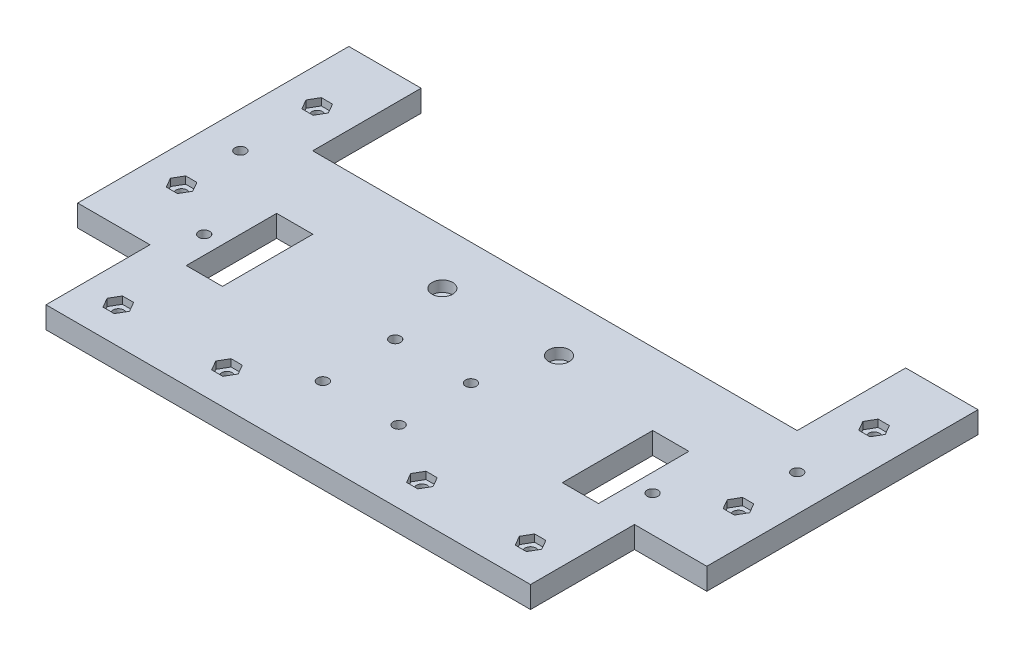
from build123d import *

# Parameters (mm, degrees)
SALIENTE_EXTRUIR1_DEPTH = 6
CORTAR_EXTRUIR1_DEPTH   = 2
CORTAR_EXTRUIR2_DEPTH   = 2
CROQUIS4_R              = 1.5
CORTAR_EXTRUIR3_DEPTH   = 12
CROQUIS5_R              = 1.5
CORTAR_EXTRUIR4_DEPTH   = 10
CROQUIS6_R              = 1.5
CORTAR_EXTRUIR5_DEPTH   = 10
CROQUIS7_R              = 1.5
CORTAR_EXTRUIR6_DEPTH   = 10
CROQUIS8_R              = 2.85
CORTAR_EXTRUIR7_DEPTH   = 3
CROQUIS9_R              = 1.5
CORTAR_EXTRUIR9_DEPTH   = 13
CROQUIS10_W             = 10
CROQUIS10_H             = 25
CORTAR_EXTRUIR10_DEPTH  = 11.3


with BuildPart() as part:
    # Croquis1 → Saliente-Extruir1 (new body)
    with BuildSketch(Plane(origin=(0, 0, 0), x_dir=(1, 0, 0), z_dir=(0, 1, 0))):
        Polygon((0, 0), (20, 0), (20, -30), (154, -30), (154, 0), (174, 0), (174, -75), (154, -75), (154, -103.75), (20, -103.75), (20, -75), (0, -75), align=None)
    extrude(amount=SALIENTE_EXTRUIR1_DEPTH)

    # Croquis2 → Cortar-Extruir1 (cut)
    with BuildSketch(Plane(origin=(0, 6, 0), x_dir=(1, 0, 0), z_dir=(0, 1, 0))):
        Polygon((8.45, -58.934678752), (11.55, -58.934678752), (13.1, -56.25), (11.55, -53.565321248), (8.45, -53.565321248), (6.9, -56.25), align=None)
        Polygon((8.45, -21.434678752), (10, -21.434678752), (11.55, -21.434678752), (13.1, -18.75), (11.55, -16.065321248), (8.45, -16.065321248), (6.9, -18.75), align=None)
        Polygon((160.9, -18.75), (162.45, -21.434678752), (165.55, -21.434678752), (167.1, -18.75), (165.55, -16.065321248), (162.45, -16.065321248), align=None)
        Polygon((160.9, -56.25), (162.45, -58.934678752), (165.55, -58.934678752), (167.1, -56.25), (165.55, -53.565321248), (162.45, -53.565321248), align=None)
        Polygon((31.55, -96.434678752), (33.1, -93.75), (31.55, -91.065321248), (28.45, -91.065321248), (26.9, -93.75), (28.45, -96.434678752), align=None)
        Polygon((140.9, -93.75), (142.45, -96.434678752), (145.55, -96.434678752), (147.1, -93.75), (145.55, -91.065321248), (142.45, -91.065321248), align=None)
        Polygon((110.85, -93.75), (112.4, -96.434678752), (115.5, -96.434678752), (117.05, -93.75), (115.5, -91.065321248), (112.4, -91.065321248), align=None)
        Polygon((61.6, -96.434678752), (63.15, -93.75), (61.6, -91.065321248), (58.5, -91.065321248), (56.95, -93.75), (58.5, -96.434678752), align=None)
    extrude(amount=-CORTAR_EXTRUIR1_DEPTH, mode=Mode.SUBTRACT)

    # Croquis3 → Cortar-Extruir2 (cut)
    with BuildSketch(Plane.XZ):
        Polygon((11.55, 58.934678752), (8.45, 58.934678752), (6.9, 56.25), (8.45, 53.565321248), (11.55, 53.565321248), (13.1, 56.25), align=None)
        Polygon((11.55, 21.434678752), (10, 21.434678752), (8.45, 21.434678752), (6.9, 18.75), (8.45, 16.065321248), (11.55, 16.065321248), (13.1, 18.75), align=None)
        Polygon((165.55, 21.434678752), (162.45, 21.434678752), (160.9, 18.75), (162.45, 16.065321248), (165.55, 16.065321248), (167.1, 18.75), align=None)
        Polygon((160.9, 56.25), (162.45, 53.565321248), (165.55, 53.565321248), (167.1, 56.25), (165.55, 58.934678752), (162.45, 58.934678752), align=None)
        Polygon((145.55, 96.434678752), (142.45, 96.434678752), (140.9, 93.75), (142.45, 91.065321248), (145.55, 91.065321248), (147.1, 93.75), align=None)
        Polygon((28.45, 91.065321248), (31.55, 91.065321248), (33.1, 93.75), (31.55, 96.434678752), (28.45, 96.434678752), (26.9, 93.75), align=None)
        Polygon((56.95, 93.75), (58.5, 91.065321248), (61.6, 91.065321248), (63.15, 93.75), (61.6, 96.434678752), (58.5, 96.434678752), align=None)
        Polygon((115.5, 96.434678752), (112.4, 96.434678752), (110.85, 93.75), (112.4, 91.065321248), (115.5, 91.065321248), (117.05, 93.75), align=None)
    extrude(amount=-CORTAR_EXTRUIR2_DEPTH, mode=Mode.SUBTRACT)

    # Croquis4 → Cortar-Extruir3 (cut)
    with BuildSketch(Plane(origin=(0, 6, 0), x_dir=(1, 0, 0), z_dir=(0, 1, 0))):
        with Locations(Location((10, -18.75, 0), (0, 0, 270))):
            Circle(CROQUIS4_R)
        with Locations(Location((10, -56.25, 0), (0, 0, 270))):
            Circle(CROQUIS4_R)
        with Locations(Location((30, -93.75, 0), (0, 0, 270))):
            Circle(CROQUIS4_R)
        with Locations(Location((60.05, -93.75, 0), (0, 0, 270))):
            Circle(CROQUIS4_R)
        with Locations(Location((113.95, -93.75, 0), (0, 0, 270))):
            Circle(CROQUIS4_R)
        with Locations(Location((144, -93.75, 0), (0, 0, 270))):
            Circle(CROQUIS4_R)
        with Locations(Location((164, -56.25, 0), (0, 0, 270))):
            Circle(CROQUIS4_R)
        with Locations(Location((164, -18.75, 0), (0, 0, 270))):
            Circle(CROQUIS4_R)
    extrude(amount=-CORTAR_EXTRUIR3_DEPTH, mode=Mode.SUBTRACT)

    # Croquis5 → Cortar-Extruir4 (cut)
    with BuildSketch(Plane(origin=(0, 6, 0), x_dir=(1, 0, 0), z_dir=(0, 1, 0))):
        with Locations(Location((76.563206093, -83.75, 0), (0, 0, 270))):
            Circle(CROQUIS5_R)
        with Locations(Location((97.521068698, -83.75, 0), (0, 0, 270))):
            Circle(CROQUIS5_R)
    extrude(amount=-CORTAR_EXTRUIR4_DEPTH, mode=Mode.SUBTRACT)

    # Croquis6 → Cortar-Extruir5 (cut)
    with BuildSketch(Plane(origin=(0, 6, 0), x_dir=(1, 0, 0), z_dir=(0, 1, 0))):
        with Locations(Location((76.563206093, -63.745122472, 0), (0, 0, 270))):
            Circle(CROQUIS6_R)
        with Locations(Location((97.521068698, -63.75, 0), (0, 0, 270))):
            Circle(CROQUIS6_R)
    extrude(amount=-CORTAR_EXTRUIR5_DEPTH, mode=Mode.SUBTRACT)

    # Croquis7 → Cortar-Extruir6 (cut)
    with BuildSketch(Plane(origin=(0, 6, 0), x_dir=(1, 0, 0), z_dir=(0, 1, 0))):
        with Locations(Location((10, -40, 0), (0, 0, 270))):
            Circle(CROQUIS7_R)
        with Locations(Location((25, -65, 0), (0, 0, 270))):
            Circle(CROQUIS7_R)
        with Locations(Location((164, -40, 0), (0, 0, 270))):
            Circle(CROQUIS7_R)
        with Locations(Location((149, -65, 0), (0, 0, 270))):
            Circle(CROQUIS7_R)
    extrude(amount=-CORTAR_EXTRUIR6_DEPTH, mode=Mode.SUBTRACT)

    # Croquis8 → Cortar-Extruir7 (cut)
    with BuildSketch(Plane(origin=(0, 6, 0), x_dir=(1, 0, 0), z_dir=(0, 1, 0))):
        with Locations(Location((70.87, -45, 0), (0, 0, 270))):
            Circle(CROQUIS8_R)
        with Locations(Location((103.13, -45, 0), (0, 0, 270))):
            Circle(CROQUIS8_R)
    extrude(amount=-CORTAR_EXTRUIR7_DEPTH, mode=Mode.SUBTRACT)

    # Croquis9 → Cortar-Extruir9 (cut)
    with BuildSketch(Plane(origin=(0, 3, 0), x_dir=(1, 0, 0), z_dir=(0, 1, 0))):
        with Locations(Location((70.87, -45, 0), (0, 0, 270))):
            Circle(CROQUIS9_R)
        with Locations(Location((103.13, -45, 0), (0, 0, 270))):
            Circle(CROQUIS9_R)
    extrude(amount=-CORTAR_EXTRUIR9_DEPTH, mode=Mode.SUBTRACT)

    # Croquis10 → Cortar-Extruir10 (cut)
    with BuildSketch(Plane.XZ):
        with Locations((139, 62.456092312)):
            Rectangle(CROQUIS10_W, CROQUIS10_H)
        with Locations((35, 62.456092312)):
            Rectangle(CROQUIS10_W, CROQUIS10_H)
    extrude(amount=-CORTAR_EXTRUIR10_DEPTH, mode=Mode.SUBTRACT)


solid = part.part
